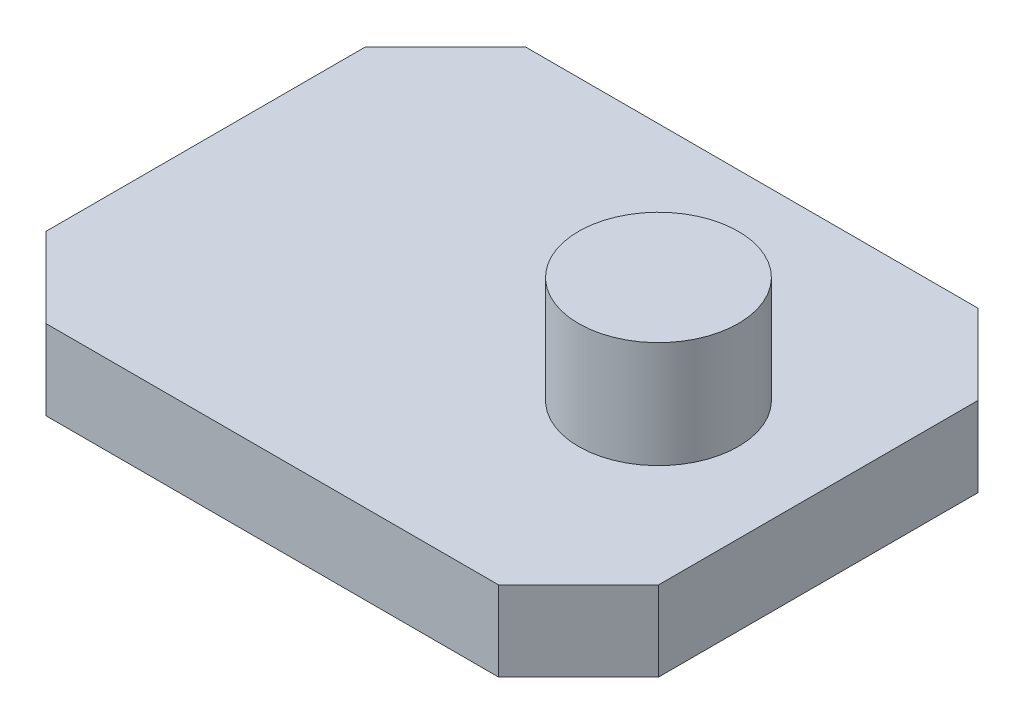
from build123d import *

# Parameters (mm, degrees)
SKETCH_1_W      = 23
SKETCH_1_H      = 18
EXTRUDE_1_DEPTH = 1.5
CHAMFER_1_SIZE  = 3
SKETCH_2_R      = 3
EXTRUDE_2_DEPTH = 4


with BuildPart() as part:
    # 草图1 → 凸台-拉伸1 (new, symmetric)
    with BuildSketch(Plane(origin=(0, 0, 0), x_dir=(1, 0, 0), z_dir=(0, 1, 0))):
        Rectangle(SKETCH_1_W, SKETCH_1_H)
    extrude(amount=EXTRUDE_1_DEPTH, both=True)

    # 倒角1
    chamfer_1_edges = [part.edges().sort_by_distance(p)[0] for p in [
        (11.5, 0, 9),
        (-11.5, 0, 9),
        (-11.5, 0, -9),
        (11.5, 0, -9),
    ]]
    chamfer(chamfer_1_edges, length=CHAMFER_1_SIZE)

    # 草图2 → 凸台-拉伸2 (add)
    with BuildSketch(Plane(origin=(0, 1.5, 0), x_dir=(1, 0, 0), z_dir=(0, 1, 0))):
        with Locations(Location((5.5, 0, 0), (0, 0, 270))):
            Circle(SKETCH_2_R)
    extrude(amount=EXTRUDE_2_DEPTH)


solid = part.part
